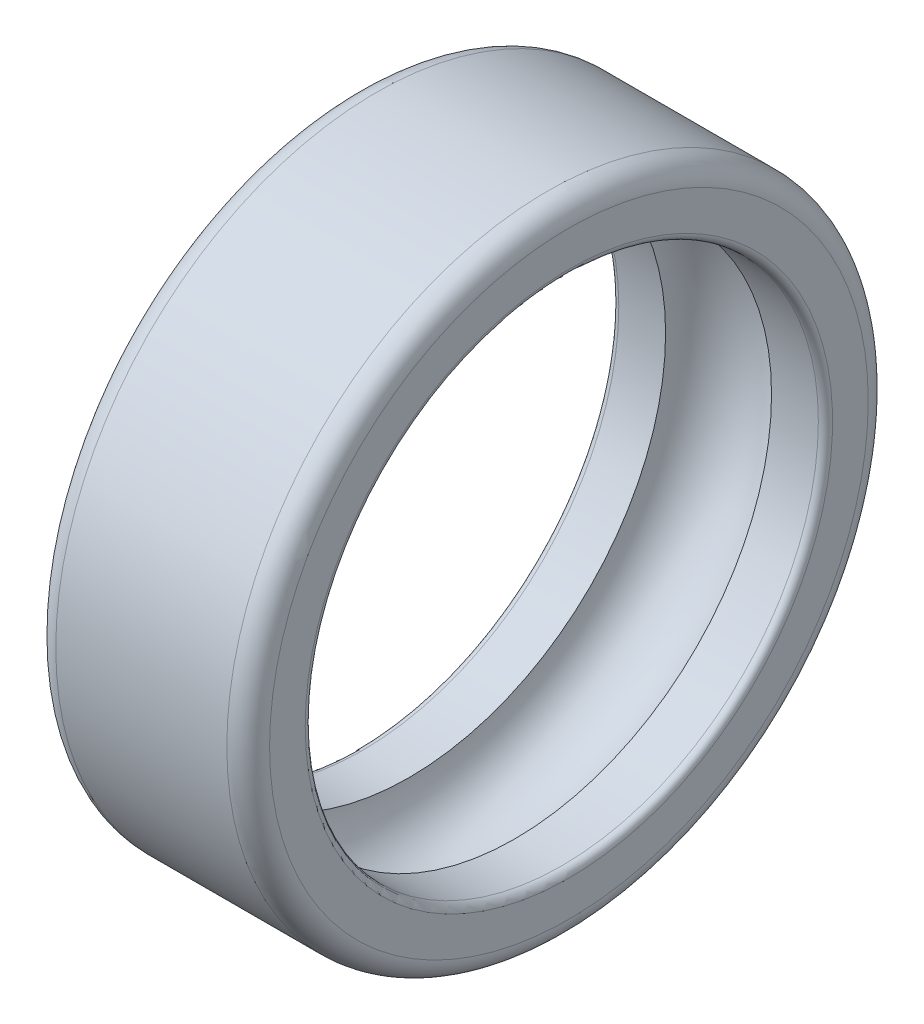
from build123d import *


with BuildPart() as part:
    # Sketch1 → Revolve1 (revolve)
    with BuildSketch(Plane(origin=(0, 0, 0), x_dir=(-1, 0, 0), z_dir=(0, 0, -1)), mode=Mode.PRIVATE) as revolve1_sk:
        with BuildLine():
            Line((-6.9, 16.65), (-6.243303437, 16.65))
            ThreePointArc((-6.243303437, 16.65), (-5.5, 17.3), (-4.756696563, 16.65))
            Line((-4.756696563, 16.65), (-4.1, 16.65))
            ThreePointArc((-4.1, 16.65), (-4.029289322, 16.679289322), (-4, 16.75))
            Line((-4, 16.75), (-4, 17.25))
            ThreePointArc((-4, 17.25), (-4.087867966, 17.462132034), (-4.3, 17.55))
            Line((-4.3, 17.55), (-6.7, 17.55))
            ThreePointArc((-6.7, 17.55), (-6.912132034, 17.462132034), (-7, 17.25))
            Line((-7, 17.25), (-7, 16.75))
            ThreePointArc((-7, 16.75), (-6.970710678, 16.679289322), (-6.9, 16.65))
        make_face()
    revolve(revolve1_sk.sketch.rotate(Axis((8.051399781, 13.05, 0), (-1, 0, 0)), 270), axis=Axis((8.051399781, 13.05, 0), (-1, 0, 0)))


solid = part.part
